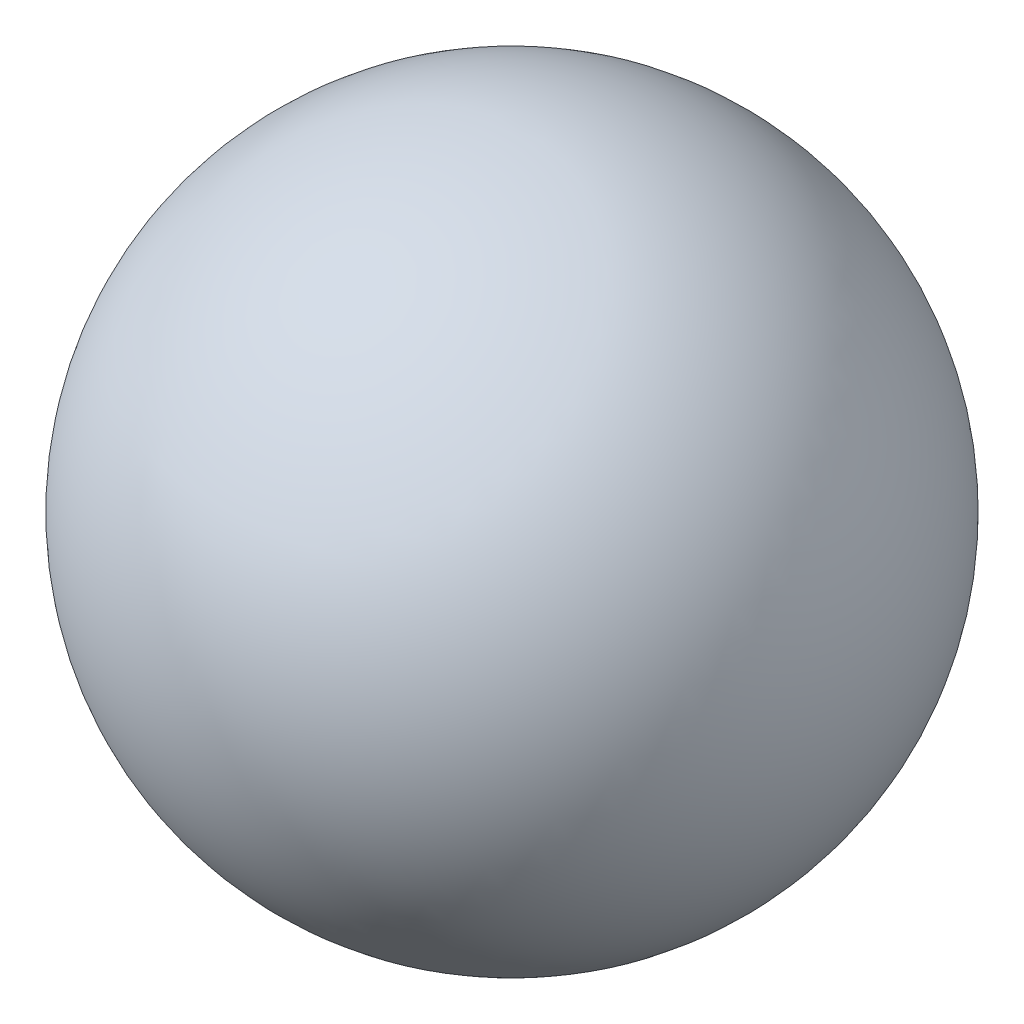
from build123d import *


with BuildPart() as part:
    # Sketch1 → Revolve1 (revolve)
    with BuildSketch(Plane(origin=(0, 0, 0), x_dir=(0, 0, -1), z_dir=(1, 0, 0))):
        with BuildLine():
            Line((0, 4), (0, -4))
            ThreePointArc((0, -4), (-4, 0), (0, 4))
        make_face()
    revolve(axis=Axis((0, 4, 0), (0, -1, 0)))


solid = part.part
